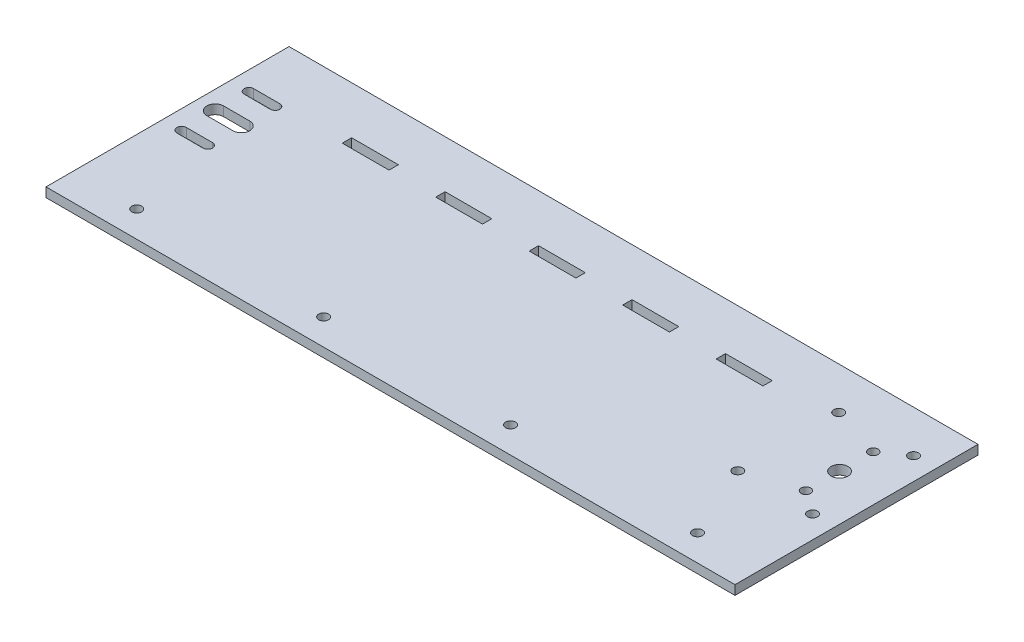
from build123d import *

# Parameters (mm, degrees)
SKETCH1_R           = 2.65
SKETCH1_R_2         = 2.55
SKETCH1_R_3         = 4.5
SKETCH1_W           = 25
SKETCH1_H           = 5
BOSS_EXTRUDE1_DEPTH = 5


with BuildPart() as part:
    # Sketch1 → Boss-Extrude1 (new body)
    with BuildSketch(Plane(origin=(0, 0, 0), x_dir=(1, 0, 0), z_dir=(0, 1, 0))):
        Polygon((0, 0), (0, 40), (0, 65), (-368.537, 65), (-368.537, -65), (0, -65), align=None)
        with Locations(Location((-12, 42.5, 0), (0, 0, 270))):
            Circle(SKETCH1_R, mode=Mode.SUBTRACT)
        with Locations(Location((-24.537, 33.5, 0), (0, 0, 270))):
            Circle(SKETCH1_R_2, mode=Mode.SUBTRACT)
        with Locations(Location((-24.537, -2.5, 0), (0, 0, 270))):
            Circle(SKETCH1_R_2, mode=Mode.SUBTRACT)
        with Locations(Location((-24.537, 15.5, 0), (0, 0, 270))):
            Circle(SKETCH1_R_3, mode=Mode.SUBTRACT)
        with Locations(Location((-12, -11.5, 0), (0, 0, 90))):
            Circle(SKETCH1_R, mode=Mode.SUBTRACT)
        with Locations(Location((-334.037, -51, 0), (0, 0, 270))):
            Circle(SKETCH1_R, mode=Mode.SUBTRACT)
        with Locations(Location((-234.037, -51, 0), (0, 0, 270))):
            Circle(SKETCH1_R, mode=Mode.SUBTRACT)
        with Locations(Location((-134.037, -51, 0), (0, 0, 270))):
            Circle(SKETCH1_R, mode=Mode.SUBTRACT)
        with Locations(Location((-34.037, -51, 0), (0, 0, 270))):
            Circle(SKETCH1_R, mode=Mode.SUBTRACT)
        with Locations(Location((-52, -11.5, 0), (0, 0, 270))):
            Circle(SKETCH1_R, mode=Mode.SUBTRACT)
        with Locations(Location((-52, 42.5, 0), (0, 0, 90))):
            Circle(SKETCH1_R, mode=Mode.SUBTRACT)
        with BuildLine():
            Line((-358.537, 20), (-344.537, 20))
            ThreePointArc((-344.537, 20), (-340.037, 15.5), (-344.537, 11))
            Line((-344.537, 11), (-358.537, 11))
            ThreePointArc((-358.537, 11), (-363.037, 15.5), (-358.537, 20))
        make_face(mode=Mode.SUBTRACT)
        with BuildLine():
            Line((-344.5, 0.05), (-358.5, 0.05))
            ThreePointArc((-358.5, 0.05), (-361.05, -2.5), (-358.5, -5.05))
            Line((-358.5, -5.05), (-344.5, -5.05))
            ThreePointArc((-344.5, -5.05), (-341.95, -2.5), (-344.5, 0.05))
        make_face(mode=Mode.SUBTRACT)
        with Locations((-297.055571099, 37)):
            Rectangle(SKETCH1_W, SKETCH1_H, mode=Mode.SUBTRACT)
        with Locations((-247.055571099, 37)):
            Rectangle(SKETCH1_W, SKETCH1_H, mode=Mode.SUBTRACT)
        with BuildLine():
            Line((-358.5, 36.05), (-344.5, 36.05))
            ThreePointArc((-344.5, 36.05), (-341.95, 33.5), (-344.5, 30.95))
            Line((-344.5, 30.95), (-358.5, 30.95))
            ThreePointArc((-358.5, 30.95), (-361.05, 33.5), (-358.5, 36.05))
        make_face(mode=Mode.SUBTRACT)
        with Locations((-197.055571099, 37)):
            Rectangle(SKETCH1_W, SKETCH1_H, mode=Mode.SUBTRACT)
        with Locations((-147.055571099, 37)):
            Rectangle(SKETCH1_W, SKETCH1_H, mode=Mode.SUBTRACT)
        with Locations((-97.055571099, 37)):
            Rectangle(SKETCH1_W, SKETCH1_H, mode=Mode.SUBTRACT)
    extrude(amount=BOSS_EXTRUDE1_DEPTH)


solid = part.part
